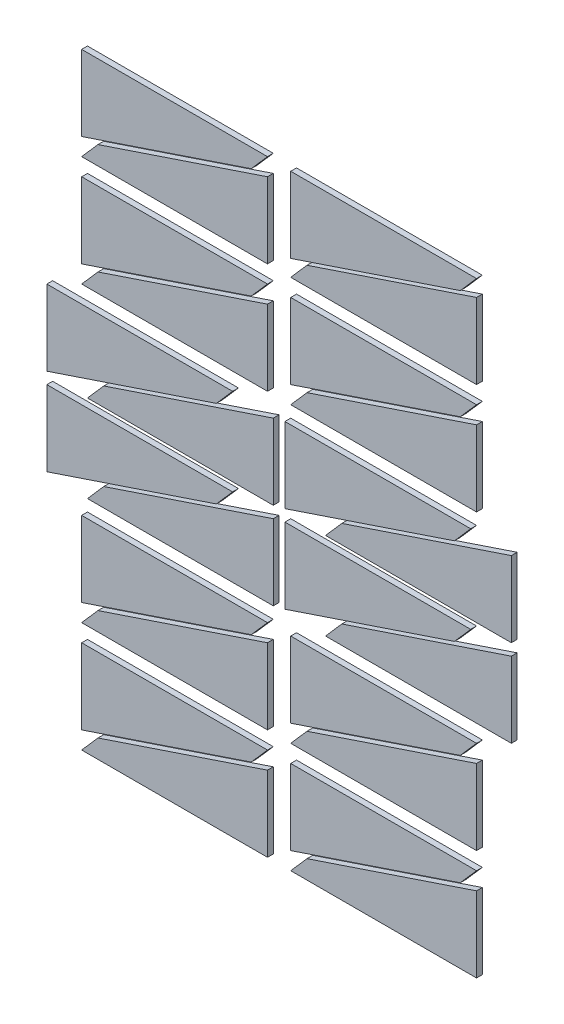
from build123d import *

# Parameters (mm, degrees)
BOSS_EXTRUDE1_DEPTH    = 1
BOSS_EXTRUDE1_2_DEPTH  = 1
BOSS_EXTRUDE1_3_DEPTH  = 1
BOSS_EXTRUDE1_4_DEPTH  = 1
BOSS_EXTRUDE1_5_DEPTH  = 1
BOSS_EXTRUDE1_6_DEPTH  = 1
BOSS_EXTRUDE1_7_DEPTH  = 1
BOSS_EXTRUDE1_8_DEPTH  = 1
BOSS_EXTRUDE1_9_DEPTH  = 1
BOSS_EXTRUDE1_10_DEPTH = 1
BOSS_EXTRUDE1_11_DEPTH = 1
BOSS_EXTRUDE1_12_DEPTH = 1
BOSS_EXTRUDE1_13_DEPTH = 1
BOSS_EXTRUDE1_14_DEPTH = 1
BOSS_EXTRUDE1_15_DEPTH = 1
BOSS_EXTRUDE1_16_DEPTH = 1
BOSS_EXTRUDE1_17_DEPTH = 1
BOSS_EXTRUDE1_18_DEPTH = 1
BOSS_EXTRUDE1_19_DEPTH = 1
BOSS_EXTRUDE1_20_DEPTH = 1
BOSS_EXTRUDE1_21_DEPTH = 1
BOSS_EXTRUDE1_22_DEPTH = 1
BOSS_EXTRUDE1_23_DEPTH = 1
BOSS_EXTRUDE1_24_DEPTH = 1


with BuildPart() as part:
    # Sketch 21 → Boss-Extrude1 (new body)
    with BuildSketch(Plane.XY):
        Polygon((39, 2.5), (7, 2.5), (9.8, 5.7), (39, 15.5), align=None)
    extrude(amount=BOSS_EXTRUDE1_DEPTH)


with BuildPart() as body_2:
    # Sketch 21 → Boss-Extrude1 2 (new body)
    with BuildSketch(Plane.XY):
        Polygon((7, 18.5), (39, 18.5), (36.2, 15.3), (7, 5.5), align=None)
    extrude(amount=BOSS_EXTRUDE1_2_DEPTH)


with BuildPart() as body_3:
    # Sketch 21 → Boss-Extrude1 3 (new body)
    with BuildSketch(Plane.XY):
        Polygon((43, 18.5), (75, 18.5), (72.2, 15.3), (43, 5.5), align=None)
    extrude(amount=BOSS_EXTRUDE1_3_DEPTH)


with BuildPart() as body_4:
    # Sketch 21 → Boss-Extrude1 4 (new body)
    with BuildSketch(Plane.XY):
        Polygon((75, 2.5), (43, 2.5), (45.8, 5.7), (75, 15.5), align=None)
    extrude(amount=BOSS_EXTRUDE1_4_DEPTH)


with BuildPart() as body_5:
    # Sketch 21 → Boss-Extrude1 5 (new body)
    with BuildSketch(Plane.XY):
        Polygon((39, 21.5), (7, 21.5), (9.8, 24.7), (39, 34.5), align=None)
    extrude(amount=BOSS_EXTRUDE1_5_DEPTH)


with BuildPart() as body_6:
    # Sketch 21 → Boss-Extrude1 6 (new body)
    with BuildSketch(Plane.XY):
        Polygon((7, 37.5), (39, 37.5), (36.2, 34.3), (7, 24.5), align=None)
    extrude(amount=BOSS_EXTRUDE1_6_DEPTH)


with BuildPart() as body_7:
    # Sketch 21 → Boss-Extrude1 7 (new body)
    with BuildSketch(Plane.XY):
        Polygon((43, 37.5), (75, 37.5), (72.2, 34.3), (43, 24.5), align=None)
    extrude(amount=BOSS_EXTRUDE1_7_DEPTH)


with BuildPart() as body_8:
    # Sketch 21 → Boss-Extrude1 8 (new body)
    with BuildSketch(Plane.XY):
        Polygon((75, 21.5), (43, 21.5), (45.8, 24.7), (75, 34.5), align=None)
    extrude(amount=BOSS_EXTRUDE1_8_DEPTH)


with BuildPart() as body_9:
    # Sketch 21 → Boss-Extrude1 9 (new body)
    with BuildSketch(Plane.XY):
        Polygon((40, 40.5), (8, 40.5), (10.8, 43.7), (40, 53.5), align=None)
    extrude(amount=BOSS_EXTRUDE1_9_DEPTH)


with BuildPart() as body_10:
    # Sketch 21 → Boss-Extrude1 10 (new body)
    with BuildSketch(Plane.XY):
        Polygon((1, 54), (33, 54), (30.2, 50.8), (1, 41), align=None)
    extrude(amount=BOSS_EXTRUDE1_10_DEPTH)


with BuildPart() as body_11:
    # Sketch 21 → Boss-Extrude1 11 (new body)
    with BuildSketch(Plane.XY):
        Polygon((42, 54), (74, 54), (71.2, 50.8), (42, 41), align=None)
    extrude(amount=BOSS_EXTRUDE1_11_DEPTH)


with BuildPart() as body_12:
    # Sketch 21 → Boss-Extrude1 12 (new body)
    with BuildSketch(Plane.XY):
        Polygon((81, 40.5), (49, 40.5), (51.8, 43.7), (81, 53.5), align=None)
    extrude(amount=BOSS_EXTRUDE1_12_DEPTH)


with BuildPart() as body_13:
    # Sketch 21 → Boss-Extrude1 13 (new body)
    with BuildSketch(Plane.XY):
        Polygon((40, 55.5), (8, 55.5), (10.8, 58.7), (40, 68.5), align=None)
    extrude(amount=BOSS_EXTRUDE1_13_DEPTH)


with BuildPart() as body_14:
    # Sketch 21 → Boss-Extrude1 14 (new body)
    with BuildSketch(Plane.XY):
        Polygon((1, 69), (33, 69), (30.2, 65.8), (1, 56), align=None)
    extrude(amount=BOSS_EXTRUDE1_14_DEPTH)


with BuildPart() as body_15:
    # Sketch 21 → Boss-Extrude1 15 (new body)
    with BuildSketch(Plane.XY):
        Polygon((42, 69), (74, 69), (71.2, 65.8), (42, 56), align=None)
    extrude(amount=BOSS_EXTRUDE1_15_DEPTH)


with BuildPart() as body_16:
    # Sketch 21 → Boss-Extrude1 16 (new body)
    with BuildSketch(Plane.XY):
        Polygon((81, 55.5), (49, 55.5), (51.8, 58.7), (81, 68.5), align=None)
    extrude(amount=BOSS_EXTRUDE1_16_DEPTH)


with BuildPart() as body_17:
    # Sketch 21 → Boss-Extrude1 17 (new body)
    with BuildSketch(Plane.XY):
        Polygon((39, 72), (7, 72), (9.8, 75.2), (39, 85), align=None)
    extrude(amount=BOSS_EXTRUDE1_17_DEPTH)


with BuildPart() as body_18:
    # Sketch 21 → Boss-Extrude1 18 (new body)
    with BuildSketch(Plane.XY):
        Polygon((7, 88), (39, 88), (36.2, 84.8), (7, 75), align=None)
    extrude(amount=BOSS_EXTRUDE1_18_DEPTH)


with BuildPart() as body_19:
    # Sketch 21 → Boss-Extrude1 19 (new body)
    with BuildSketch(Plane.XY):
        Polygon((43, 88), (75, 88), (72.2, 84.8), (43, 75), align=None)
    extrude(amount=BOSS_EXTRUDE1_19_DEPTH)


with BuildPart() as body_20:
    # Sketch 21 → Boss-Extrude1 20 (new body)
    with BuildSketch(Plane.XY):
        Polygon((75, 72), (43, 72), (45.8, 75.2), (75, 85), align=None)
    extrude(amount=BOSS_EXTRUDE1_20_DEPTH)


with BuildPart() as body_21:
    # Sketch 21 → Boss-Extrude1 21 (new body)
    with BuildSketch(Plane.XY):
        Polygon((39, 91), (7, 91), (9.8, 94.2), (39, 104), align=None)
    extrude(amount=BOSS_EXTRUDE1_21_DEPTH)


with BuildPart() as body_22:
    # Sketch 21 → Boss-Extrude1 22 (new body)
    with BuildSketch(Plane.XY):
        Polygon((7, 107), (39, 107), (36.2, 103.8), (7, 94), align=None)
    extrude(amount=BOSS_EXTRUDE1_22_DEPTH)


with BuildPart() as body_23:
    # Sketch 21 → Boss-Extrude1 23 (new body)
    with BuildSketch(Plane.XY):
        Polygon((43, 106.82), (75, 106.82), (72.2, 103.62), (43, 93.82), align=None)
    extrude(amount=BOSS_EXTRUDE1_23_DEPTH)


with BuildPart() as body_24:
    # Sketch 21 → Boss-Extrude1 24 (new body)
    with BuildSketch(Plane.XY):
        Polygon((75, 91), (43, 91), (45.8, 94.2), (75, 104), align=None)
    extrude(amount=BOSS_EXTRUDE1_24_DEPTH)


solid = Compound([part.part, body_2.part, body_3.part, body_4.part, body_5.part, body_6.part, body_7.part, body_8.part, body_9.part, body_10.part, body_11.part, body_12.part, body_13.part, body_14.part, body_15.part, body_16.part, body_17.part, body_18.part, body_19.part, body_20.part, body_21.part, body_22.part, body_23.part, body_24.part])
